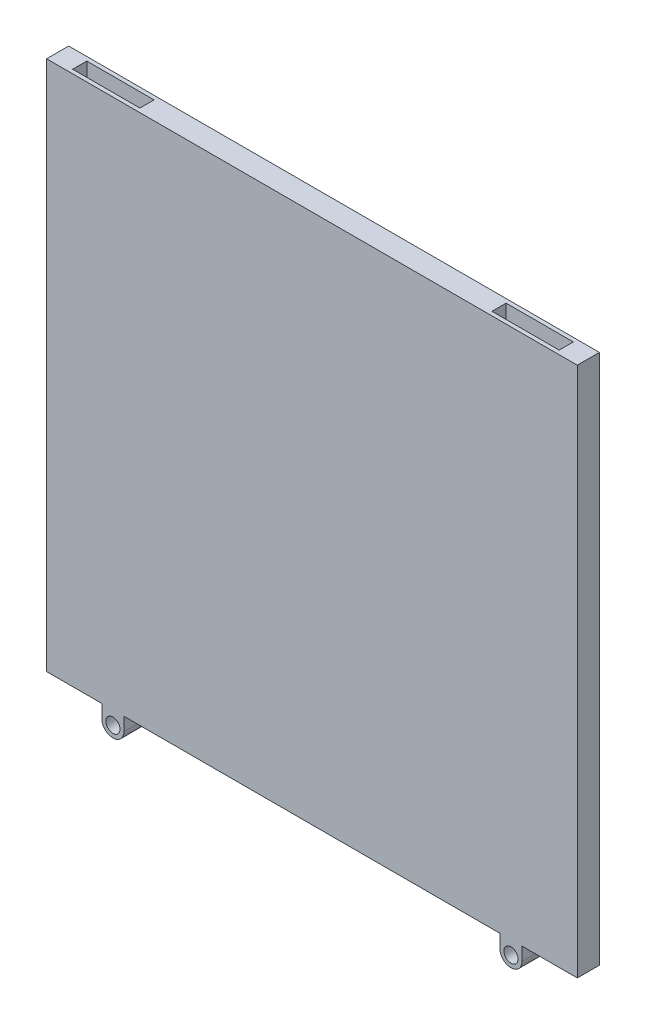
from build123d import *

# Parameters (mm, degrees)
SKETCH1_W           = 120
SKETCH1_H           = 120
BOSS_EXTRUDE1_DEPTH = 2.5
SKETCH4_W           = 15.2
SKETCH4_H           = 3.2
CUT_EXTRUDE1_DEPTH  = 20
SKETCH6_R           = 1.6
BOSS_EXTRUDE2_DEPTH = 5


with BuildPart() as part:
    # Sketch1 → Boss-Extrude1 (new, symmetric)
    with BuildSketch(Plane.XY):
        Rectangle(SKETCH1_W, SKETCH1_H)
    extrude(amount=BOSS_EXTRUDE1_DEPTH, both=True)

    # Sketch4 → Cut-Extrude1 (cut)
    with BuildSketch(Plane(origin=(0, 60, 0), x_dir=(1, 0, 0), z_dir=(0, 1, 0))):
        with Locations((-47.4, 0)):
            Rectangle(SKETCH4_W, SKETCH4_H)
        with Locations((47.4, 0)):
            Rectangle(SKETCH4_W, SKETCH4_H)
    extrude(amount=-CUT_EXTRUDE1_DEPTH, mode=Mode.SUBTRACT)

    # Sketch6 → Boss-Extrude2 (add)
    with BuildSketch(Plane.XY.offset(2.5)):
        with BuildLine():
            Line((42.5, -60), (47.5, -60))
            Line((47.5, -60), (47.5, -63))
            ThreePointArc((47.5, -63), (45, -65.5), (42.5, -63))
            Line((42.5, -63), (42.5, -60))
        make_face()
        with Locations((45, -63)):
            Circle(SKETCH6_R, mode=Mode.SUBTRACT)
    boss_extrude2 = extrude(amount=-BOSS_EXTRUDE2_DEPTH)

    # Mirror1: Boss-Extrude2 across plane
    add(boss_extrude2.mirror(Plane(origin=(0, 0, 0), x_dir=(0, 0, 1), z_dir=(1, 0, 0))))


solid = part.part
